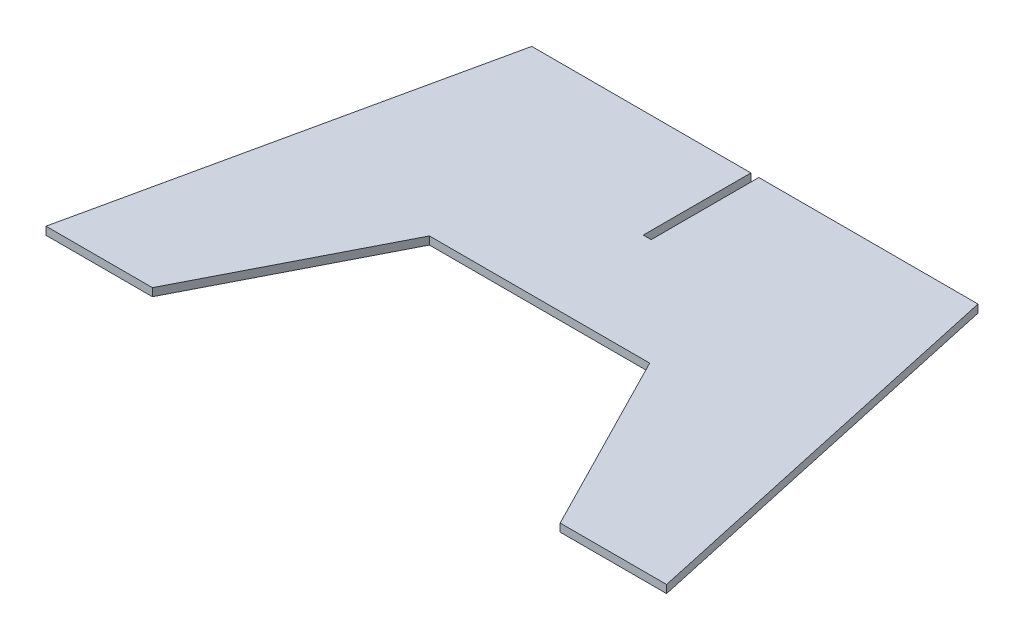
from build123d import *

# Parameters (mm, degrees)
BOSS_EXTRUDE1_DEPTH = 0.8636


with BuildPart() as part:
    # Sketch1 → Boss-Extrude1 (new body)
    with BuildSketch(Plane(origin=(0, 0, 0), x_dir=(1, 0, 0), z_dir=(0, 1, 0))):
        Polygon((-24.35, 43.5), (-33.8636, 0), (-22.25, 0), (-12.020114943, 20), (12.020114943, 20), (22.25, 0), (33.8636, 0), (24.35, 43.5), (0.4318, 43.5), (0.4318, 31.75), (-0.4318, 31.75), (-0.4318, 43.5), align=None)
    extrude(amount=BOSS_EXTRUDE1_DEPTH)


solid = part.part
